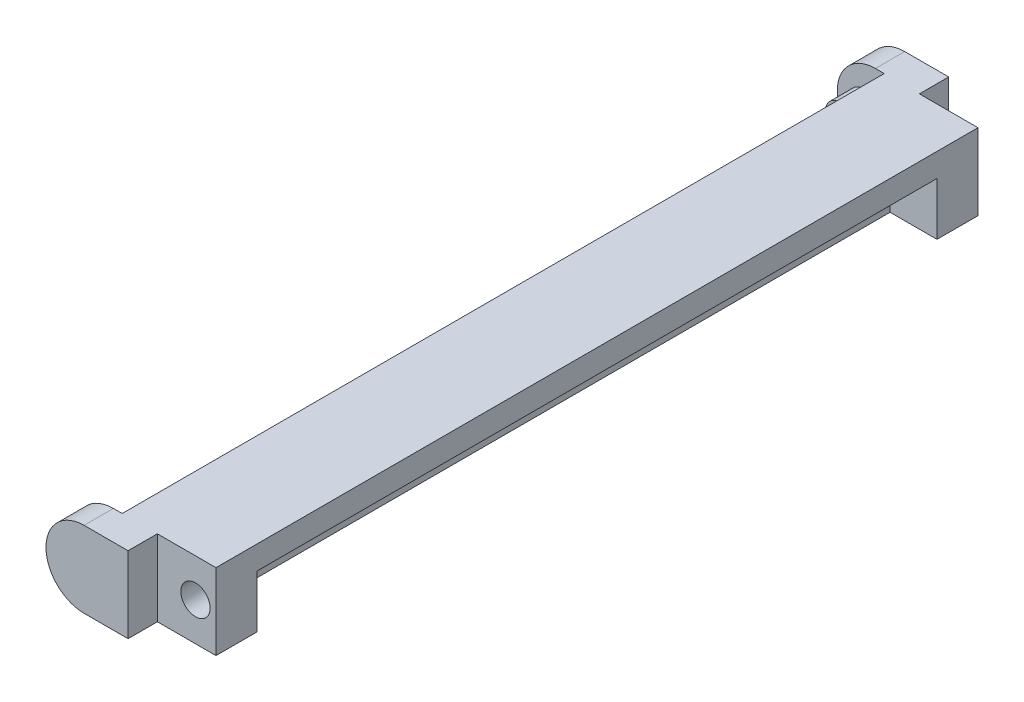
from build123d import *

# Parameters (mm, degrees)
BOSS_EXTRUDE1_DEPTH = 6.5
CUT_EXTRUDE3_DEPTH  = 71.600991494
SKETCH4_W           = 4
SKETCH4_H           = 58
SKETCH4_W_2         = 1.7
SKETCH4_H_2         = 65
CUT_EXTRUDE4_DEPTH  = 4.5
SKETCH5_R           = 1.25
BOSS_EXTRUDE2_DEPTH = 2
SKETCH6_R           = 1.25
CUT_EXTRUDE5_DEPTH  = 2


with BuildPart() as part:
    # Sketch1 → Boss-Extrude1 (new body)
    with BuildSketch(Plane(origin=(0, 0, 0), x_dir=(1, 0, 0), z_dir=(0, 1, 0))):
        Polygon((1.5, -32.5), (6.5, -32.5), (6.5, 32.5), (1.5, 32.5), (1.5, 35), (-5.5, 35), (-5.5, 32.5), (-1.5, 32.5), (-1.5, -32.5), (-5.5, -32.5), (-5.5, -35), (1.5, -35), align=None)
    extrude(amount=-BOSS_EXTRUDE1_DEPTH)

    # Sketch3 → Cut-Extrude3 (cut, through all)
    with BuildSketch(Plane.XY.offset(35)):
        with BuildLine():
            Line((-5.5, -6.5), (-2.25, -6.5))
            ThreePointArc((-2.25, -6.5), (-4.548097039, -5.548097039), (-5.5, -3.25))
            Line((-5.5, -3.25), (-5.5, -6.5))
        make_face()
        with BuildLine():
            Line((-5.5, 0), (-5.5, -3.25))
            ThreePointArc((-5.5, -3.25), (-4.548097039, -0.951902961), (-2.25, 0))
            Line((-2.25, 0), (-5.5, 0))
        make_face()
    extrude(amount=-CUT_EXTRUDE3_DEPTH, mode=Mode.SUBTRACT)

    # Sketch4 → Cut-Extrude4 (cut)
    with BuildSketch(Plane.XZ.offset(6.5)):
        with Locations((4.5, 0)):
            Rectangle(SKETCH4_W, SKETCH4_H)
        with Locations((-0.65, 0)):
            Rectangle(SKETCH4_W_2, SKETCH4_H_2)
    extrude(amount=-CUT_EXTRUDE4_DEPTH, mode=Mode.SUBTRACT)

    # Sketch5 → Boss-Extrude2 (add)
    with BuildSketch(Plane.XY.offset(-32.5)):
        with Locations((-3.25, -3.25)):
            Circle(SKETCH5_R)
    boss_extrude2 = extrude(amount=BOSS_EXTRUDE2_DEPTH)

    # Sketch6 → Cut-Extrude5 (cut)
    with BuildSketch(Plane(origin=(0, 0, -32.5), x_dir=(-1, 0, 0), z_dir=(0, 0, -1))):
        with Locations((-4.75, -3.25)):
            Circle(SKETCH6_R)
    cut_extrude5 = extrude(amount=-CUT_EXTRUDE5_DEPTH, mode=Mode.SUBTRACT)

    # Mirror1: Boss-Extrude2, Cut-Extrude5 across plane
    add(boss_extrude2.mirror(Plane.XY))
    add(cut_extrude5.mirror(Plane.XY), mode=Mode.SUBTRACT)


solid = part.part
